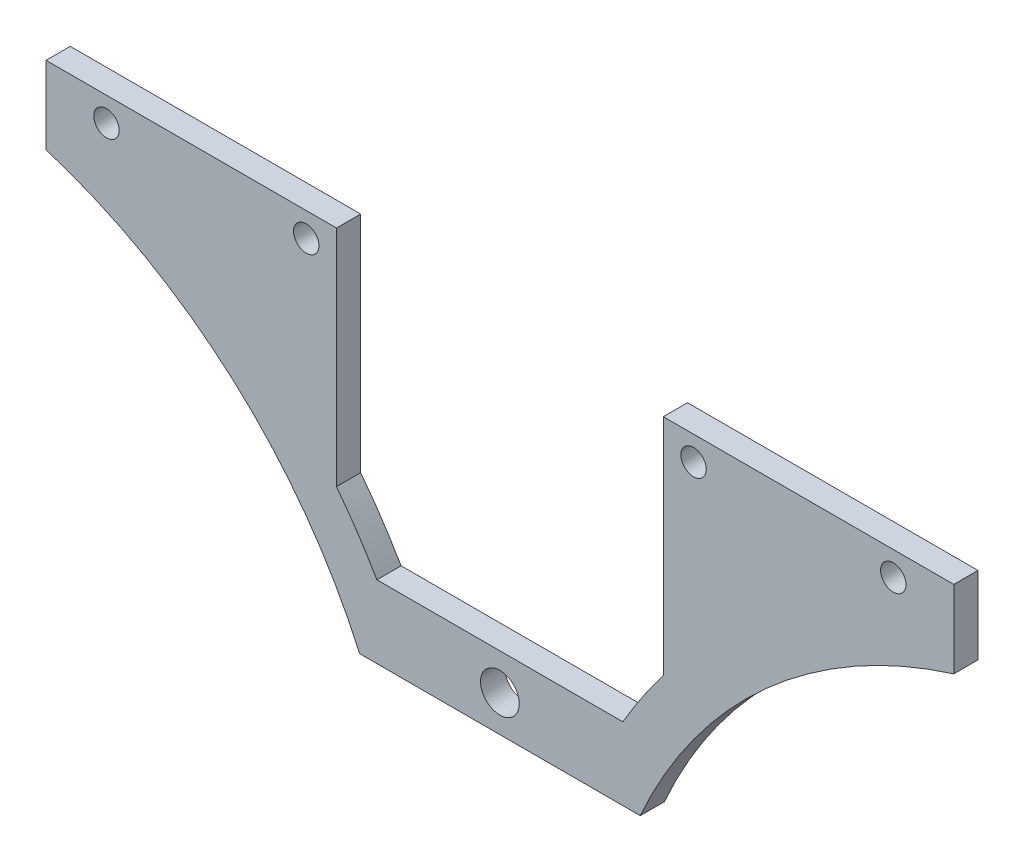
from build123d import *

# Parameters (mm, degrees)
SKETCH_1_R          = 1.6
EXTRUDE_1_DEPTH     = 2
SKETCH_2_R          = 1.05
CUT_EXTRUDE_1_DEPTH = 10


with BuildPart() as part:
    # 草图1 → 凸台-拉伸1 (new body)
    with BuildSketch(Plane.XY):
        with BuildLine():
            Line((-10.162831426, 3), (10.162831426, 3))
            ThreePointArc((10.162831426, 3), (11.749775558, 5.55230577), (13.5, 7.995535358))
            Line((13.5, 7.995535358), (13.5, 26.5))
            Line((13.5, 26.5), (37.5, 26.5))
            Line((37.5, 26.5), (37.5, 20.096757974))
            ThreePointArc((37.5, 20.096757974), (22.049805692, 11.349428036), (11.594271261, -3))
            Line((11.594271261, -3), (-11.594271261, -3))
            ThreePointArc((-11.594271261, -3), (-22.049805692, 11.349428036), (-37.5, 20.096757974))
            Line((-37.5, 20.096757974), (-37.5, 26.5))
            Line((-37.5, 26.5), (-13.5, 26.5))
            Line((-13.5, 26.5), (-13.5, 7.995535358))
            ThreePointArc((-13.5, 7.995535358), (-11.749775558, 5.55230577), (-10.162831426, 3))
        make_face()
        Circle(SKETCH_1_R, mode=Mode.SUBTRACT)
    extrude(amount=EXTRUDE_1_DEPTH)

    # 草图2 → 切除-拉伸1 (cut)
    with BuildSketch(Plane.XY.offset(2)):
        with Locations((-32.5, 24.5)):
            Circle(SKETCH_2_R)
        with Locations((-16, 24.5)):
            Circle(SKETCH_2_R)
        with Locations((16, 24.5)):
            Circle(SKETCH_2_R)
        with Locations((32.5, 24.5)):
            Circle(SKETCH_2_R)
    extrude(amount=-CUT_EXTRUDE_1_DEPTH, mode=Mode.SUBTRACT)


solid = part.part
